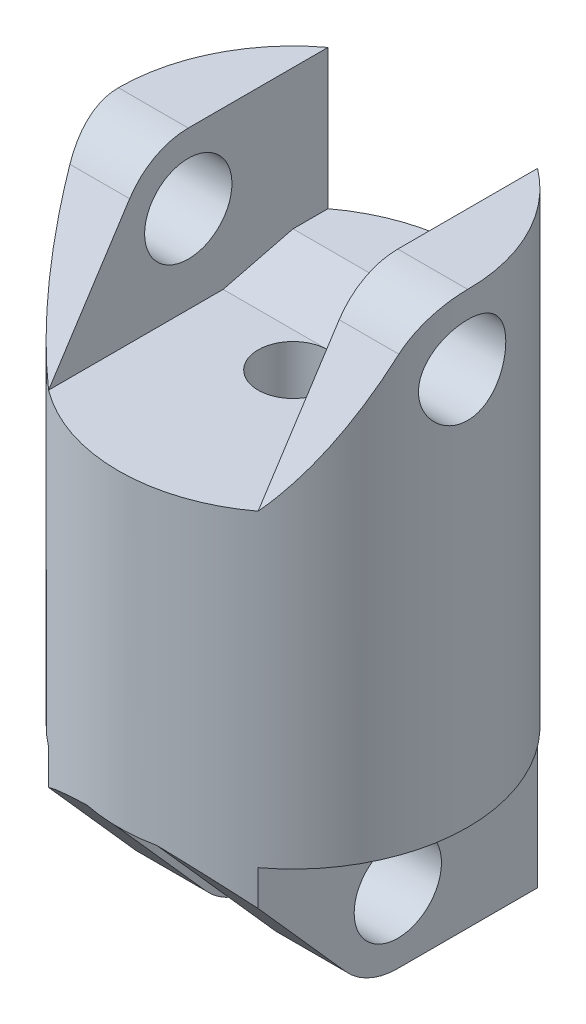
from build123d import *

# Parameters (mm, degrees)
SKETCH1_R               = 12.7
BOSS_EXTRUDE1_DEPTH     = 45.3136
CUT_EXTRUDE1_START      = -11.43
CUT_EXTRUDE1_DEPTH      = 11.43
CUT_EXTRUDE2_DEPTH      = 11.43
CUT_EXTRUDE3_DEPTH      = 52.259289353
CUT_EXTRUDE3_DEPTH_BACK = 52.259289353
SKETCH4_R               = 3.175
SKETCH5_R               = 2.54
CUT_EXTRUDE4_DEPTH      = 39.349424517
BOSS_EXTRUDE2_REACH     = 53.259
BOSS_EXTRUDE3_DEPTH     = 1.27


with BuildPart() as part:
    # Sketch1 → Boss-Extrude1 (new body)
    with BuildSketch(Plane(origin=(0, 0, 0), x_dir=(1, 0, 0), z_dir=(0, 1, 0))):
        with Locations(Location((0, 0, 0), (0, 0, 90))):
            Circle(SKETCH1_R)
    extrude(amount=BOSS_EXTRUDE1_DEPTH)

    # Sketch2 → Cut-Extrude1 (cut)
    with BuildSketch(Plane(origin=(0, 45.3136, 0), x_dir=(1, 0, 0), z_dir=(0, 1, 0)).offset(CUT_EXTRUDE1_START)):
        with BuildLine():
            Line((7.62, 10.16), (7.62, -10.16))
            ThreePointArc((7.62, -10.16), (0, -12.7), (-7.62, -10.16))
            Line((-7.62, -10.16), (-7.62, 10.16))
            ThreePointArc((-7.62, 10.16), (0, 12.7), (7.62, 10.16))
        make_face()
    extrude(amount=CUT_EXTRUDE1_DEPTH, mode=Mode.SUBTRACT)

    # Sketch3 → Cut-Extrude2 (cut)
    with BuildSketch(Plane.XZ):
        with BuildLine():
            Line((-2.54, 12.443407893), (-2.54, -12.443407893))
            ThreePointArc((-2.54, -12.443407893), (0, -12.7), (2.54, -12.443407893))
            Line((2.54, -12.443407893), (2.54, 12.443407893))
            ThreePointArc((2.54, 12.443407893), (0, 12.7), (-2.54, 12.443407893))
        make_face()
        with BuildLine():
            Line((-7.62, 10.16), (-7.62, -10.16))
            ThreePointArc((-7.62, -10.16), (-12.7, 0), (-7.62, 10.16))
        make_face()
        with BuildLine():
            Line((7.62, 10.16), (7.62, -10.16))
            ThreePointArc((7.62, -10.16), (12.7, 0), (7.62, 10.16))
        make_face()
    extrude(amount=-CUT_EXTRUDE2_DEPTH, mode=Mode.SUBTRACT)

    # Sketch4 → Cut-Extrude3 (cut, two sides: drawn at the far end of the back side and taken through both)
    with BuildSketch(Plane(origin=(-7.62, 0, 0), x_dir=(0, 0, -1), z_dir=(1, 0, 0)).offset(-CUT_EXTRUDE3_DEPTH_BACK)):
        with Locations(Location((0, 40.2336, 0), (0, 0, 270))):
            Circle(SKETCH4_R)
        with Locations((0, 5.08)):
            Circle(SKETCH4_R)
        with BuildLine():
            Line((0, 45.3136), (-10.16, 45.3136))
            Line((-10.16, 45.3136), (-10.16, 33.8836))
            Line((-10.16, 33.8836), (-4.264917923, 42.993468677))
            ThreePointArc((-4.264917923, 42.993468677), (-2.427577715, 44.696028312), (0, 45.3136))
        make_face()
        with BuildLine():
            Line((-3.796422114, 1.704562379), (-12.443407893, 11.43))
            Line((-12.443407893, 11.43), (-12.443407893, 0))
            Line((-12.443407893, 0), (0, 0))
            ThreePointArc((0, 0), (-2.080766311, 0.445691901), (-3.796422114, 1.704562379))
        make_face()
    extrude(amount=CUT_EXTRUDE3_DEPTH + CUT_EXTRUDE3_DEPTH_BACK, mode=Mode.SUBTRACT)

    # Sketch5 → Cut-Extrude4 (cut, through all)
    with BuildSketch(Plane(origin=(0, 33.8836, 0), x_dir=(1, 0, 0), z_dir=(0, 1, 0))):
        with Locations(Location((0, 0, 0), (0, 0, 270))):
            Circle(SKETCH5_R)
    extrude(amount=-CUT_EXTRUDE4_DEPTH, mode=Mode.SUBTRACT)

    # Boss-Extrude2: up to this face of the body (flat: up to its plane)
    boss_extrude2_end = Plane(part.part.faces().sort_by_distance((7.62, 34.116741009, 0))[0])
    # Sketch6 → Boss-Extrude2 (add, up to the picked face)
    with BuildSketch(Plane(origin=(-7.62, 0, 0), x_dir=(0, 0, -1), z_dir=(1, 0, 0)), mode=Mode.PRIVATE) as boss_extrude2_sk1:
        Polygon((2.54, 33.8836), (10.16, 33.8836), (10.16, 35.1536), (7.62, 35.1536), align=None)
    boss_extrude2_tool1 = split(extrude(boss_extrude2_sk1.sketch, amount=BOSS_EXTRUDE2_REACH, mode=Mode.PRIVATE), bisect_by=boss_extrude2_end, keep=Keep.BOTH, mode=Mode.PRIVATE)
    add(boss_extrude2_tool1.solids().sort_by(Axis((-7.62, 34.412767, -7.408333), (1, 0, 0)))[0])

    # Sketch7 → Boss-Extrude3 (add)
    with BuildSketch(Plane(origin=(0, 33.8836, 0), x_dir=(1, 0, 0), z_dir=(0, 1, 0))):
        with BuildLine():
            Line((-7.62, 10.16), (7.62, 10.16))
            ThreePointArc((7.62, 10.16), (0, 12.7), (-7.62, 10.16))
        make_face()
    extrude(amount=BOSS_EXTRUDE3_DEPTH)


solid = part.part
